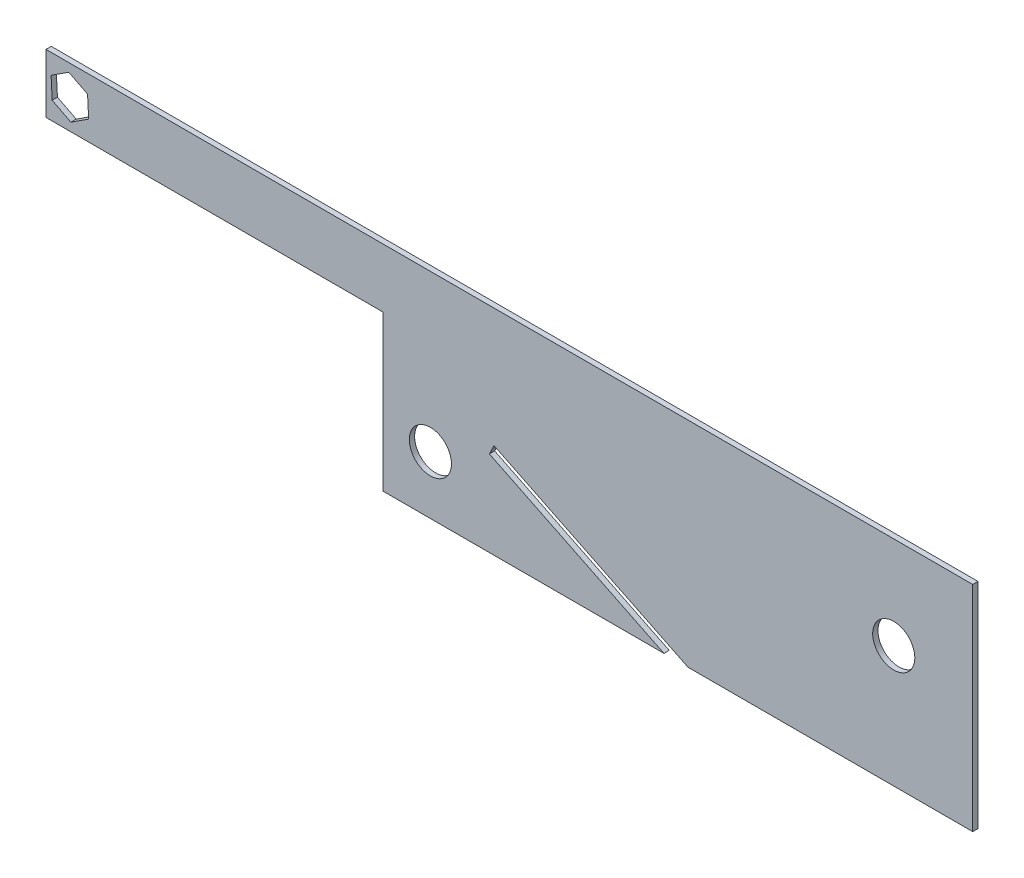
from build123d import *

# Parameters (mm, degrees)
SKETCH5_R           = 12.7
BOSS_EXTRUDE4_DEPTH = 3.175


with BuildPart() as part:
    # Sketch5 → Boss-Extrude4 (new body)
    with BuildSketch(Plane.XY):
        Polygon((0, 35.56), (0, 0), (203.2, 0), (203.2, -93.533944169), (372.637377726, -93.533944169), (267.345580387, -42.014632685), (270.136458661, -36.310818307), (387.085338563, -93.533944169), (558.8, -93.533944169), (558.8, 35.56), align=None)
        with Locations((231.775, -58.608944169)):
            Circle(SKETCH5_R, mode=Mode.SUBTRACT)
        Polygon((25.06325275, 24.691281209), (25.711364465, 11.991281209), (15.036897694, 5.08), (3.714319208, 10.868718791), (3.066207494, 23.568718791), (13.740674265, 30.48), align=None, mode=Mode.SUBTRACT)
        with Locations((511.175, -20.248310315)):
            Circle(SKETCH5_R, mode=Mode.SUBTRACT)
    extrude(amount=BOSS_EXTRUDE4_DEPTH)


solid = part.part
